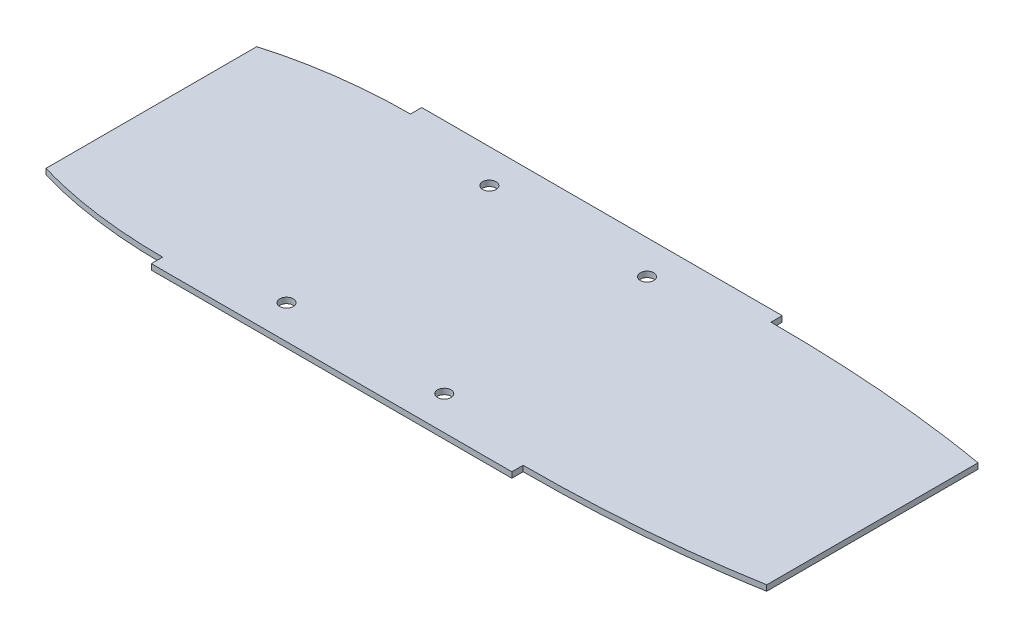
from build123d import *

# Parameters (mm, degrees)
BOSS_EXTRUDE1_DEPTH   = 25.4
SKETCH4_W             = 63.5
SKETCH4_H             = 76.2
CUT_EXTRUDE4_DEPTH    = 0.01
F_6_CLEARANCE_HOLE1_D = 3.7973
CUT_EXTRUDE5_DEPTH    = 3.5052
SKETCH8_R             = 1.89865
BOSS_EXTRUDE2_DEPTH   = 1.5875
SKETCH9_W             = 83.512513563
SKETCH9_H             = 26.66457596
CUT_EXTRUDE7_DEPTH    = 309.355274367
SKETCH10_W            = 76.2
SKETCH10_H            = 78.034990754
SKETCH10_W_2          = 120.649995745
SKETCH10_H_2          = 89.760717872
CUT_EXTRUDE8_DEPTH    = 305.02593568


with BuildPart() as part:
    # Sketch1 → Boss-Extrude1 (new body)
    with BuildSketch(Plane(origin=(0, 0, 0), x_dir=(1, 0, 0), z_dir=(0, 1, 0))):
        with BuildLine():
            Line((76.2, 38.1), (177.8, 38.1))
            add(Edge.make_bspline(
                [(177.8, -38.1), (304.8, -38.1), (304.8, 0), (304.8, 38.1), (177.8, 38.1)],
                knots=[4.71238898, 4.71238898, 4.71238898, 6.283185307, 6.283185307, 7.853981634, 7.853981634, 7.853981634], degree=2, weights=[1, 0.707106781, 1, 0.707106781, 1]))
            Line((177.8, -38.1), (76.2, -38.1))
            add(Edge.make_bspline(
                [(76.2, 38.1), (0, 38.1), (0, 0), (0, -38.1), (76.2, -38.1)],
                knots=[4.71238898, 4.71238898, 4.71238898, 6.283185307, 6.283185307, 7.853981634, 7.853981634, 7.853981634], degree=2, weights=[1, 0.707106781, 1, 0.707106781, 1]))
        make_face()
    extrude(amount=BOSS_EXTRUDE1_DEPTH)

    # Sketch4 → Cut-Extrude4 (cut)
    with BuildSketch(Plane.XZ):
        with Locations((107.95, 0)):
            Rectangle(SKETCH4_W, SKETCH4_H)
    extrude(amount=-CUT_EXTRUDE4_DEPTH, mode=Mode.SUBTRACT)

    # #6 Clearance Hole1 (through all)
    with Locations(Plane(origin=(0, 25.4, 0), x_dir=(1, 0, 0), z_dir=(0, 1, 0))):
        with Locations((104.775, 28.575), (149.225, 28.575), (149.225, -28.575), (104.775, -28.575)):
            Hole(F_6_CLEARANCE_HOLE1_D / 2)

    # Sketch7 → Cut-Extrude5 (cut)
    with BuildSketch(Plane(origin=(0, 25.4, 0), x_dir=(1, 0, 0), z_dir=(0, 1, 0))):
        Polygon((144.092356107, 28.575), (146.658678053, 24.13), (151.791321947, 24.13), (154.357643893, 28.575), (151.791321947, 33.02), (146.658678053, 33.02), align=None)
        Polygon((144.092356107, -28.575), (146.658678053, -33.02), (151.791321947, -33.02), (154.357643893, -28.575), (151.791321947, -24.13), (146.658678053, -24.13), align=None)
        Polygon((99.642356107, -28.575), (102.208678053, -33.02), (107.341321947, -33.02), (109.907643893, -28.575), (107.341321947, -24.13), (102.208678053, -24.13), align=None)
        Polygon((99.642356107, 28.575), (102.208678053, 24.13), (107.341321947, 24.13), (109.907643893, 28.575), (107.341321947, 33.02), (102.208678053, 33.02), align=None)
    extrude(amount=-CUT_EXTRUDE5_DEPTH, mode=Mode.SUBTRACT)

    # Sketch8 → Boss-Extrude2 (add)
    with BuildSketch(Plane(origin=(0, 25.4, 0), x_dir=(1, 0, 0), z_dir=(0, 1, 0))):
        with BuildLine():
            Line((76.2, 34.925), (76.2, 38.1))
            Line((76.2, 38.1), (177.8, 38.1))
            Line((177.8, 38.1), (177.8, 34.925))
            add(Edge.make_bspline(
                [(177.8, -34.925), (183.4037084, -34.925), (188.998492342, -34.813401269), (200.169898566, -34.363095557), (205.746528757, -34.024487469), (216.880255629, -33.103008305), (222.437375795, -32.520430902), (230.75625716, -31.436497802), (233.526404303, -31.040006826), (239.060480939, -30.169274267), (241.826062226, -29.694714405), (250.088902803, -28.143630441), (255.558584053, -26.942274462), (262.328557631, -25.151722447), (263.679135198, -24.778907782), (266.372677584, -24.000520191), (267.71682163, -23.594573907), (271.725857042, -22.324580042), (274.36743953, -21.409387606), (279.569151408, -19.39956311), (282.129804397, -18.306084526), (285.88296458, -16.472402408), (287.119225286, -15.828587024), (289.55372457, -14.457194234), (290.752112946, -13.729946828), (293.096789788, -12.16067691), (294.246150852, -11.316137328), (295.874693947, -9.951173652), (296.402758109, -9.47890107), (297.421867434, -8.491073847), (297.913370929, -7.974720766), (298.834097865, -6.902845016), (299.265206405, -6.34585568), (300.051083084, -5.176943461), (300.406626859, -4.564345705), (301.008906586, -3.265877479), (301.246986609, -2.597792892), (301.485043085, -1.560074348), (301.544634961, -1.206113764), (301.617830117, -0.494585391), (301.644885041, 0.214202137), (301.581423052, 0.917612733), (301.474094585, 1.618417551), (301.397802992, 1.969801613), (301.111287523, 3.001503382), (300.846416268, 3.65704054), (300.206739898, 4.920093421), (299.828668717, 5.531043925), (299.007148253, 6.686383823), (298.562585264, 7.234082094), (297.622788002, 8.284550248), (297.127404223, 8.787187569), (296.096077792, 9.756500131), (295.558527194, 10.224239157), (293.916424424, 11.566158841), (292.777517596, 12.385848353), (290.439906756, 13.923799855), (289.240807105, 14.641390764), (286.797257835, 15.999650314), (285.552669877, 16.640084306), (283.027180157, 17.859357093), (281.744712958, 18.438732265), (279.156163214, 19.543403236), (277.854905585, 20.066703794), (273.933809615, 21.564574536), (271.296832059, 22.467878334), (265.988924804, 24.133309881), (263.317871138, 24.894922167), (255.263773486, 27.00954075), (249.84032756, 28.194552175), (238.914613399, 30.236824809), (233.411910816, 31.092279963), (225.108785934, 32.171421056), (222.333695526, 32.496639974), (216.783621708, 33.081533661), (214.006661761, 33.341462159), (205.670357358, 34.029518973), (200.105614733, 34.366364864), (188.962770448, 34.814156957), (183.384662687, 34.925), (177.8, 34.925)],
                knots=[0, 0, 0, 0, 0.0625, 0.0625, 0.125, 0.125, 0.1875, 0.1875, 0.21875, 0.21875, 0.25, 0.25, 0.3125, 0.3125, 0.328125, 0.328125, 0.34375, 0.34375, 0.375, 0.375, 0.40625, 0.40625, 0.421875, 0.421875, 0.4375, 0.4375, 0.453125, 0.453125, 0.4609375, 0.4609375, 0.46875, 0.46875, 0.4765625, 0.4765625, 0.484375, 0.484375, 0.4921875, 0.4921875, 0.49609375, 0.49609375, 0.5, 0.50390625, 0.50390625, 0.5078125, 0.5078125, 0.515625, 0.515625, 0.5234375, 0.5234375, 0.53125, 0.53125, 0.5390625, 0.5390625, 0.546875, 0.546875, 0.5625, 0.5625, 0.578125, 0.578125, 0.59375, 0.59375, 0.609375, 0.609375, 0.625, 0.625, 0.65625, 0.65625, 0.6875, 0.6875, 0.75, 0.75, 0.8125, 0.8125, 0.84375, 0.84375, 0.875, 0.875, 0.9375, 0.9375, 1, 1, 1, 1], degree=3))
            Line((177.8, -34.925), (177.8, -38.1))
            Line((177.8, -38.1), (76.2, -38.1))
            Line((76.2, -38.1), (76.2, -34.925))
            add(Edge.make_bspline(
                [(76.2, 34.925), (72.560356463, 34.925), (68.943360269, 34.792561899), (61.754441862, 34.264100128), (58.182504946, 33.868162444), (51.086537454, 32.796138329), (47.562444107, 32.120418968), (40.569083399, 30.448366491), (37.099631765, 29.453110976), (32.806027277, 27.95635597), (31.949494882, 27.644206952), (30.241174952, 26.992161717), (29.390926264, 26.65279755), (26.866144113, 25.597394738), (25.212373464, 24.842354074), (21.972821409, 23.213388071), (20.386939209, 22.339638978), (17.297386897, 20.44838632), (15.793478172, 19.43129999), (13.617299122, 17.766336528), (12.904682274, 17.187440617), (11.513561893, 15.976499308), (10.840880513, 15.349552385), (9.54783147, 14.046551814), (8.927423545, 13.37053596), (8.042889277, 12.313259261), (7.755748062, 11.953602405), (7.198395375, 11.218396794), (6.928446634, 10.843070732), (5.637961842, 8.942133597), (4.781011076, 7.331767424), (4.011479694, 5.164717753), (3.872393075, 4.721427518), (3.630991775, 3.828466268), (3.528746677, 3.379752125), (3.278693467, 2.026749947), (3.187494563, 1.115610982), (3.170545544, -0.265601808), (3.185103724, -0.730659272), (3.254432294, -1.653608423), (3.308896513, -2.110722742), (3.528648511, -3.46965449), (3.750177803, -4.359086655), (4.185155464, -5.670622337), (4.348017487, -6.105682935), (4.702753212, -6.959314098), (4.89428858, -7.377540069), (5.507317523, -8.608922615), (5.967053776, -9.398893053), (6.972472791, -10.926725455), (7.518232478, -11.66454078), (8.684660756, -13.094754944), (9.299817788, -13.780178654), (11.212125162, -15.748333857), (12.581059513, -16.950990578), (14.739480167, -18.63278064), (15.476712229, -19.172714409), (16.982909755, -20.215658543), (17.753757316, -20.719762644), (20.090686263, -22.170309278), (21.683208327, -23.057695262), (26.543466505, -25.529337744), (29.892801319, -26.925597609), (35.037930237, -28.740921547), (36.773547574, -29.298627898), (39.40495658, -30.070716914), (40.286457068, -30.317183729), (42.05035166, -30.787397156), (42.933764127, -31.011448076), (47.357777286, -32.079253653), (50.919045806, -32.767054426), (58.079539287, -33.856246888), (61.678822068, -34.257202279), (68.912834907, -34.79163745), (72.5475805, -34.925), (76.2, -34.925)],
                knots=[0, 0, 0, 0, 0.0625, 0.0625, 0.125, 0.125, 0.1875, 0.1875, 0.25, 0.25, 0.265625, 0.265625, 0.28125, 0.28125, 0.3125, 0.3125, 0.34375, 0.34375, 0.375, 0.375, 0.390625, 0.390625, 0.40625, 0.40625, 0.421875, 0.421875, 0.4296875, 0.4296875, 0.4375, 0.4375, 0.46875, 0.46875, 0.4765625, 0.4765625, 0.484375, 0.484375, 0.5, 0.5, 0.5078125, 0.5078125, 0.515625, 0.515625, 0.53125, 0.53125, 0.5390625, 0.5390625, 0.546875, 0.546875, 0.5625, 0.5625, 0.578125, 0.578125, 0.59375, 0.59375, 0.625, 0.625, 0.640625, 0.640625, 0.65625, 0.65625, 0.6875, 0.6875, 0.75, 0.75, 0.78125, 0.78125, 0.796875, 0.796875, 0.8125, 0.8125, 0.875, 0.875, 0.9375, 0.9375, 1, 1, 1, 1], degree=3))
        make_face()
        with Locations(Location((149.225, 28.575, 0), (0, 0, 270))):
            Circle(SKETCH8_R, mode=Mode.SUBTRACT)
        with Locations(Location((149.225, -28.575, 0), (0, 0, 270))):
            Circle(SKETCH8_R, mode=Mode.SUBTRACT)
        with Locations(Location((104.775, -28.575, 0), (0, 0, 270))):
            Circle(SKETCH8_R, mode=Mode.SUBTRACT)
        with Locations(Location((104.775, 28.575, 0), (0, 0, 270))):
            Circle(SKETCH8_R, mode=Mode.SUBTRACT)
    extrude(amount=BOSS_EXTRUDE2_DEPTH)

    # Sketch9 → Cut-Extrude7 (cut, through all)
    with BuildSketch(Plane(origin=(0, 0, 0), x_dir=(0, 0, -1), z_dir=(1, 0, 0))):
        with Locations((0.469171425, 12.06771202)):
            Rectangle(SKETCH9_W, SKETCH9_H)
    extrude(amount=CUT_EXTRUDE7_DEPTH, mode=Mode.SUBTRACT)

    # Sketch10 → Cut-Extrude8 (cut, through all)
    with BuildSketch(Plane.XZ.offset(-25.4)):
        Rectangle(SKETCH10_W, SKETCH10_H)
        with Locations((301.624997872, -0.000109313)):
            Rectangle(SKETCH10_W_2, SKETCH10_H_2)
    extrude(amount=-CUT_EXTRUDE8_DEPTH, mode=Mode.SUBTRACT)


solid = part.part
